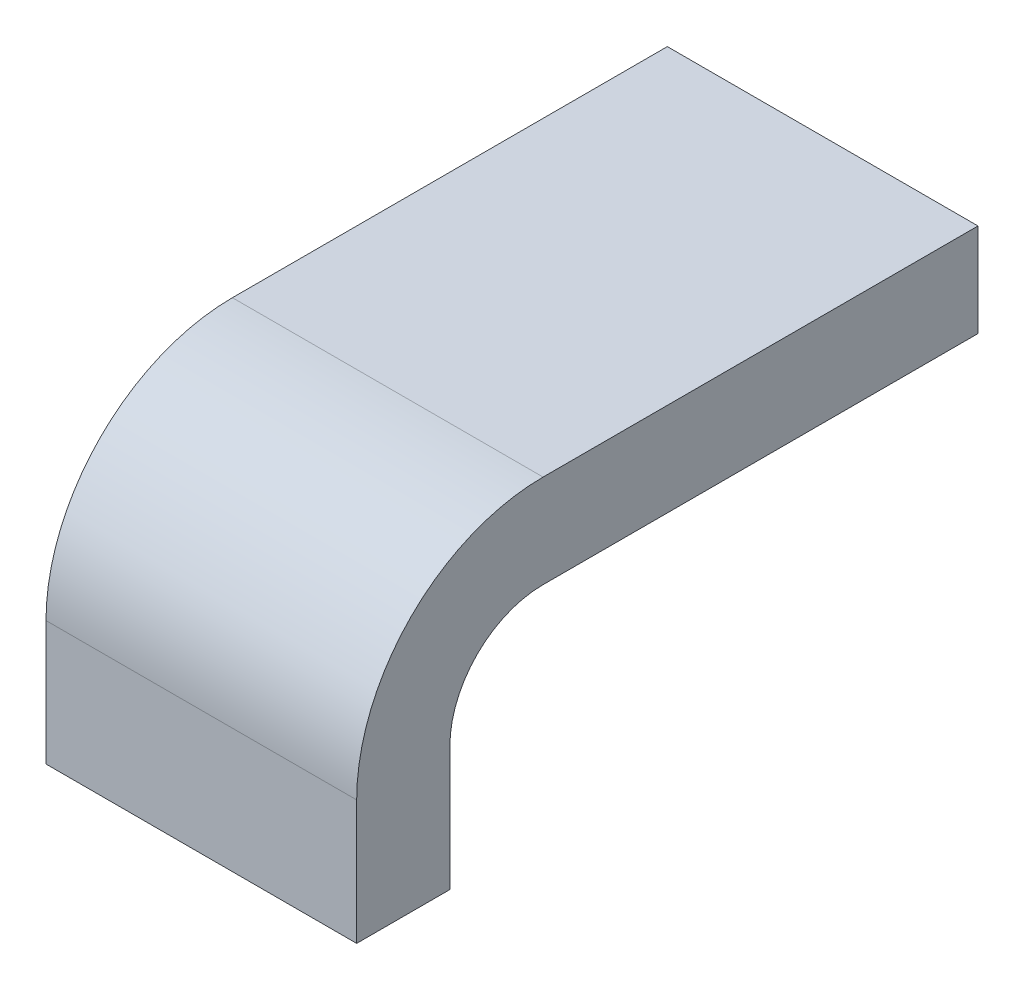
from build123d import *

# Parameters (mm, degrees)
EXTRUDE_1_DEPTH = 5


with BuildPart() as part:
    # 草圖2 → 填料-伸長1 (new, symmetric)
    with BuildSketch(Plane(origin=(0, 0, 0), x_dir=(0, 0, -1), z_dir=(1, 0, 0))):
        with BuildLine():
            Line((5.260663507, 5.28436019), (-8.739336493, 5.28436019))
            ThreePointArc((-8.739336493, 5.28436019), (-12.98197718, 3.527000877), (-14.739336493, -0.71563981))
            Line((-14.739336493, -0.71563981), (-14.739336493, -4.71563981))
            Line((-14.739336493, -4.71563981), (-11.739336493, -4.71563981))
            Line((-11.739336493, -4.71563981), (-11.739336493, -0.71563981))
            ThreePointArc((-11.739336493, -0.71563981), (-10.860656836, 1.405680533), (-8.739336493, 2.28436019))
            Line((-8.739336493, 2.28436019), (5.260663507, 2.28436019))
            Line((5.260663507, 2.28436019), (5.260663507, 5.28436019))
        make_face()
    extrude(amount=EXTRUDE_1_DEPTH, both=True)


solid = part.part
